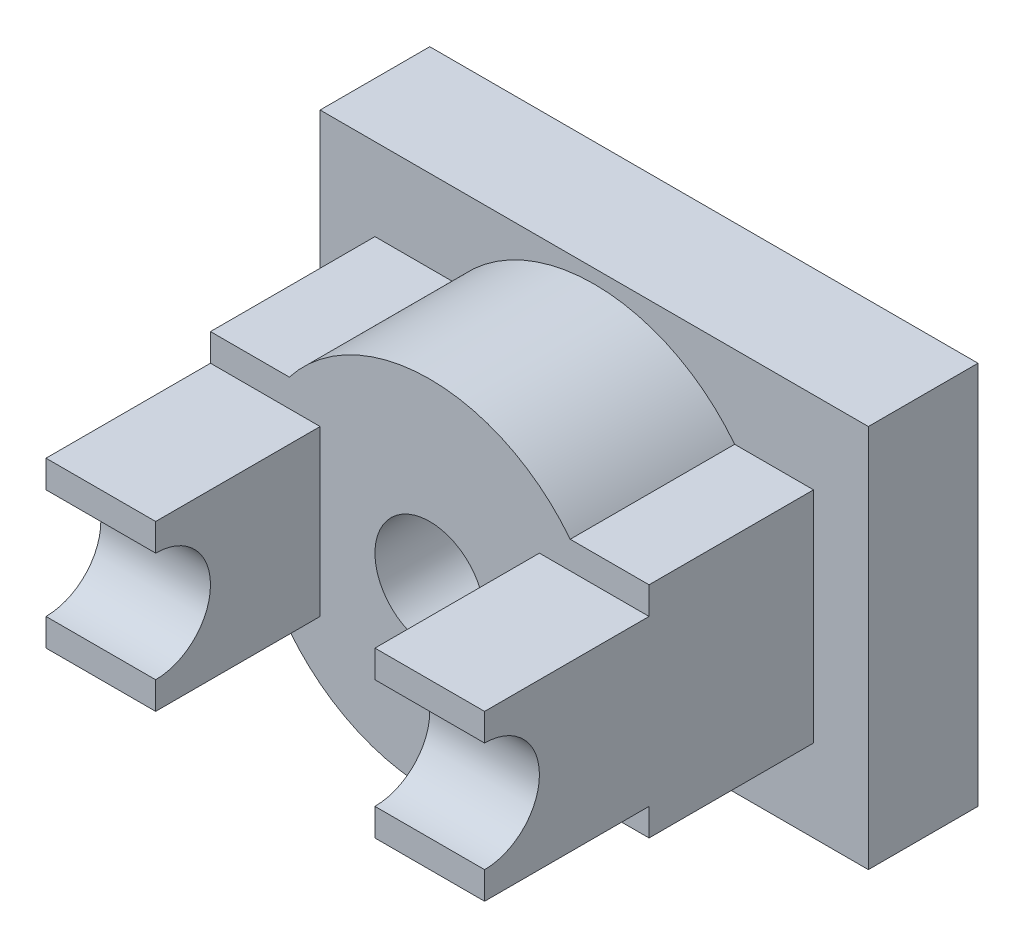
from build123d import *

# Parameters (mm, degrees)
SKETCH_1_W          = 100
SKETCH_1_H          = 70
EXTRUDE_1_DEPTH     = 20
SKETCH_2_R          = 10
EXTRUDE_2_DEPTH     = 30
SKETCH_3_W          = 20
SKETCH_3_H          = 30
EXTRUDE_3_DEPTH     = 30
CUT_EXTRUDE_1_DEPTH = 126.39936204


with BuildPart() as part:
    # 草圖1 → 填料-伸長1 (new body)
    with BuildSketch(Plane.XY):
        Rectangle(SKETCH_1_W, SKETCH_1_H)
    extrude(amount=EXTRUDE_1_DEPTH)

    # 草圖2 → 填料-伸長2 (add)
    with BuildSketch(Plane.XY.offset(20)):
        with BuildLine():
            Line((25.617376915, 20), (40, 20))
            Line((40, 20), (40, -20))
            Line((40, -20), (25.617376915, -20))
            ThreePointArc((25.617376915, -20), (0, -32.5), (-25.617376915, -20))
            Line((-25.617376915, -20), (-40, -20))
            Line((-40, -20), (-40, 20))
            Line((-40, 20), (-25.617376915, 20))
            ThreePointArc((-25.617376915, 20), (0, 32.5), (25.617376915, 20))
        make_face()
        Circle(SKETCH_2_R, mode=Mode.SUBTRACT)
    extrude(amount=EXTRUDE_2_DEPTH)

    # 草圖3 → 填料-伸長3 (add)
    with BuildSketch(Plane.XY.offset(50)):
        with Locations((30, 0)):
            Rectangle(SKETCH_3_W, SKETCH_3_H)
        with Locations((-30, 0)):
            Rectangle(SKETCH_3_W, SKETCH_3_H)
    extrude(amount=EXTRUDE_3_DEPTH)

    # 草圖4 → 除料-伸長1 (cut, through all)
    with BuildSketch(Plane.ZY.offset(40)):
        with BuildLine():
            ThreePointArc((90, 0), (87.071067812, 7.071067812), (80, 10))
            Line((80, 10), (80, -10))
            ThreePointArc((80, -10), (87.071067812, -7.071067812), (90, 0))
        make_face()
        with BuildLine():
            Line((80, -10), (80, 10))
            ThreePointArc((80, 10), (70, 0), (80, -10))
        make_face()
    extrude(amount=-CUT_EXTRUDE_1_DEPTH, mode=Mode.SUBTRACT)


solid = part.part
